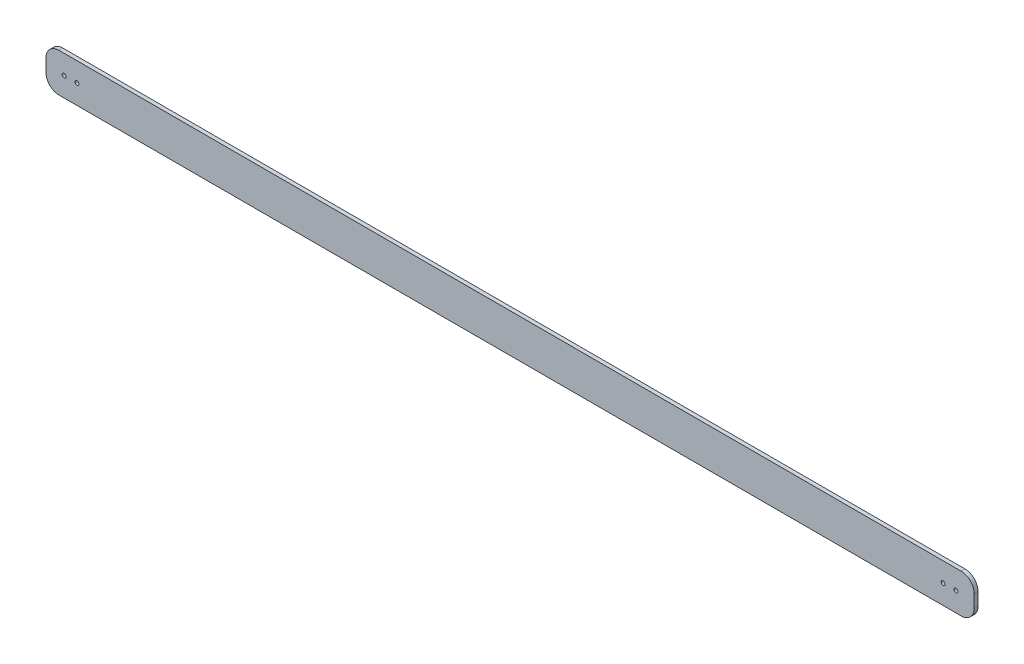
from build123d import *

# Parameters (mm, degrees)
SKETCH1_R           = 1.5
BOSS_EXTRUDE1_DEPTH = 3


with BuildPart() as part:
    # Sketch1 → Boss-Extrude1 (new body)
    with BuildSketch(Plane.XY):
        with BuildLine():
            Line((-296.816922301, 128.864864865), (401.183077699, 128.864864865))
            ThreePointArc((401.183077699, 128.864864865), (408.254145511, 125.935932677), (411.183077699, 118.864864865))
            Line((411.183077699, 118.864864865), (411.183077699, 108.864864865))
            ThreePointArc((411.183077699, 108.864864865), (408.254145511, 101.793797053), (401.183077699, 98.864864865))
            Line((401.183077699, 98.864864865), (-296.816922301, 98.864864865))
            ThreePointArc((-296.816922301, 98.864864865), (-303.887990113, 101.793797053), (-306.816922301, 108.864864865))
            Line((-306.816922301, 108.864864865), (-306.816922301, 118.864864865))
            ThreePointArc((-306.816922301, 118.864864865), (-303.887990113, 125.935932677), (-296.816922301, 128.864864865))
        make_face()
        with Locations((-292.816922301, 113.864864865)):
            Circle(SKETCH1_R, mode=Mode.SUBTRACT)
        with Locations((-282.816922301, 113.864864865)):
            Circle(SKETCH1_R, mode=Mode.SUBTRACT)
        with Locations((387.183077699, 113.864864865)):
            Circle(SKETCH1_R, mode=Mode.SUBTRACT)
        with Locations((397.183077699, 113.864864865)):
            Circle(SKETCH1_R, mode=Mode.SUBTRACT)
    extrude(amount=BOSS_EXTRUDE1_DEPTH)


solid = part.part
